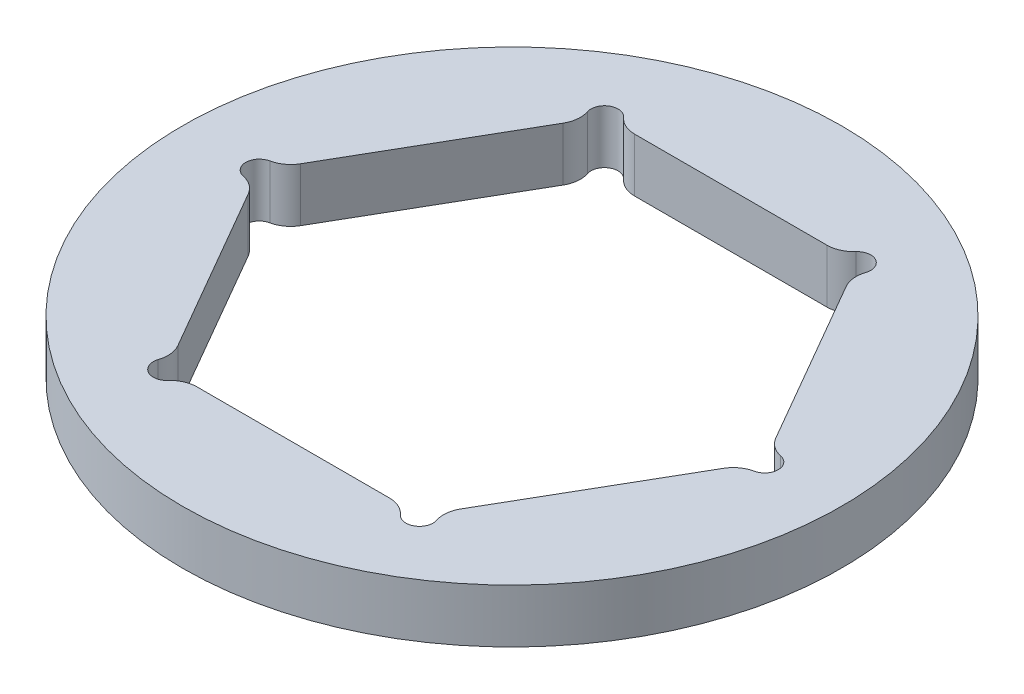
from build123d import *

# Parameters (mm, degrees)
CROQUIS1_R              = 9.7536
SALIENTE_EXTRUIR1_DEPTH = 0.79375


with BuildPart() as part:
    # Croquis1 → Saliente-Extruir1 (new, symmetric)
    with BuildSketch(Plane(origin=(0, 0, 0), x_dir=(1, 0, 0), z_dir=(0, 1, 0))):
        with Locations(Location((0, 0, 0), (0, 0, 270))):
            Circle(CROQUIS1_R)
        with BuildLine():
            Line((4.186711289, -5.702403331), (7.031781792, -0.774596669))
            ThreePointArc((7.031781792, -0.774596669), (7.255445899, -0.526605585), (7.560864296, -0.391532223))
            ThreePointArc((7.560864296, -0.391532223), (7.878995387, 0), (7.560864296, 0.391532223))
            ThreePointArc((7.560864296, 0.391532223), (7.255445899, 0.526605585), (7.031781792, 0.774596669))
            Line((7.031781792, 0.774596669), (4.186711289, 5.702403331))
            ThreePointArc((4.186711289, 5.702403331), (4.083776764, 6.020097672), (4.119509, 6.352134444))
            ThreePointArc((4.119509, 6.352134444), (3.939497694, 6.823410162), (3.441355297, 6.743666667))
            ThreePointArc((3.441355297, 6.743666667), (3.171669135, 6.546703257), (2.845070503, 6.477))
            Line((2.845070503, 6.477), (-2.845070503, 6.477))
            ThreePointArc((-2.845070503, 6.477), (-3.171669135, 6.546703257), (-3.441355297, 6.743666667))
            ThreePointArc((-3.441355297, 6.743666667), (-3.939497694, 6.823410162), (-4.119509, 6.352134444))
            ThreePointArc((-4.119509, 6.352134444), (-4.083776764, 6.020097672), (-4.186711289, 5.702403331))
            Line((-4.186711289, 5.702403331), (-7.031781792, 0.774596669))
            ThreePointArc((-7.031781792, 0.774596669), (-7.255445899, 0.526605585), (-7.560864296, 0.391532223))
            ThreePointArc((-7.560864296, 0.391532223), (-7.878995387, 0), (-7.560864296, -0.391532223))
            ThreePointArc((-7.560864296, -0.391532223), (-7.255445899, -0.526605585), (-7.031781792, -0.774596669))
            Line((-7.031781792, -0.774596669), (-4.186711289, -5.702403331))
            ThreePointArc((-4.186711289, -5.702403331), (-4.083776764, -6.020097672), (-4.119509, -6.352134444))
            ThreePointArc((-4.119509, -6.352134444), (-3.939497694, -6.823410162), (-3.441355297, -6.743666667))
            ThreePointArc((-3.441355297, -6.743666667), (-3.171669135, -6.546703257), (-2.845070503, -6.477))
            Line((-2.845070503, -6.477), (2.845070503, -6.477))
            ThreePointArc((2.845070503, -6.477), (3.171669135, -6.546703257), (3.441355297, -6.743666667))
            ThreePointArc((3.441355297, -6.743666667), (3.939497694, -6.823410162), (4.119509, -6.352134444))
            ThreePointArc((4.119509, -6.352134444), (4.083776764, -6.020097672), (4.186711289, -5.702403331))
        make_face(mode=Mode.SUBTRACT)
    extrude(amount=SALIENTE_EXTRUIR1_DEPTH, both=True)


solid = part.part
